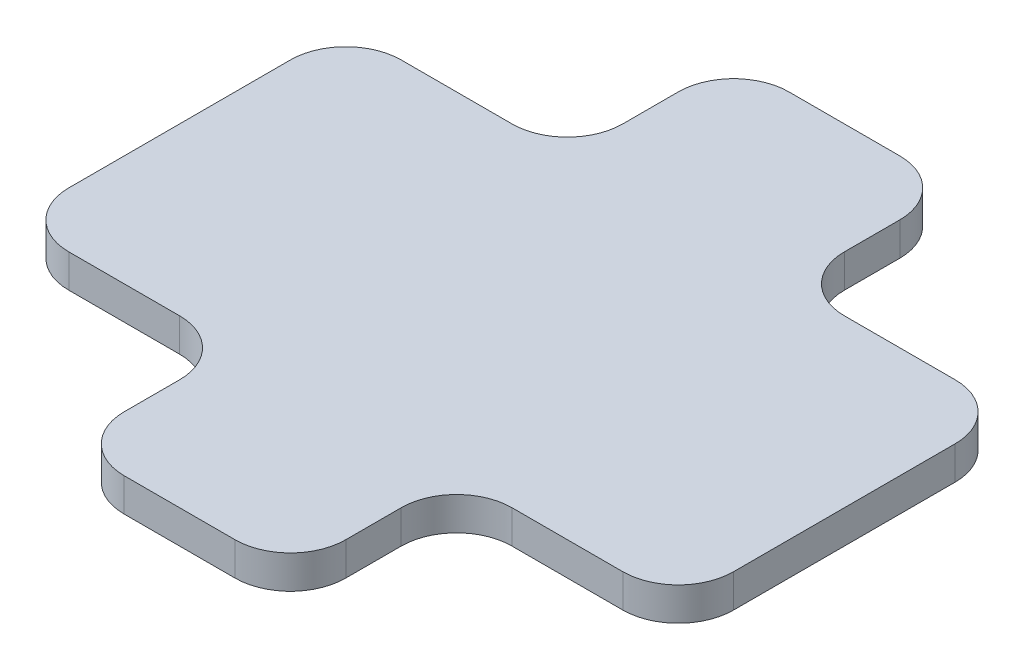
from build123d import *

# Parameters (mm, degrees)
EXTRUDE_1_DEPTH = 3
FILLET_1_R      = 5


with BuildPart() as part:
    # 草图1 → 凸台-拉伸1 (new body)
    with BuildSketch(Plane(origin=(0, 0, 0), x_dir=(1, 0, 0), z_dir=(0, 1, 0))):
        Polygon((10, 15), (30, 15), (30, -15), (10, -15), (10, -30), (-10, -30), (-10, -15), (-30, -15), (-30, 15), (-10, 15), (-10, 30), (10, 30), align=None)
    extrude(amount=EXTRUDE_1_DEPTH)

    # 圆角1
    fillet_1_edges = [part.edges().sort_by_distance(p)[0] for p in [
        (10, 1.5, 30),
        (-10, 1.5, 30),
        (-10, 1.5, 15),
        (-30, 1.5, 15),
        (-30, 1.5, -15),
        (-10, 1.5, -15),
        (-10, 1.5, -30),
        (10, 1.5, -30),
        (10, 1.5, -15),
        (30, 1.5, -15),
        (30, 1.5, 15),
        (10, 1.5, 15),
    ]]
    fillet(fillet_1_edges, radius=FILLET_1_R)


solid = part.part
